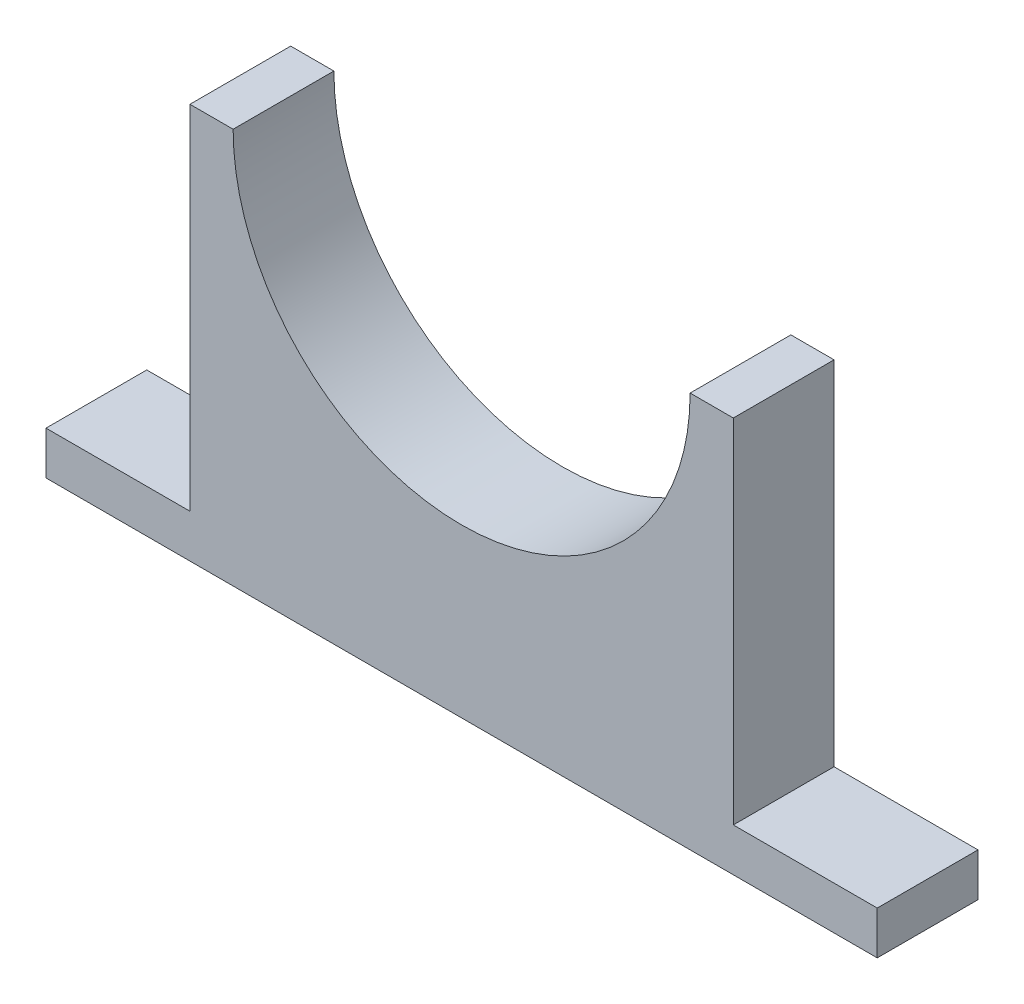
from build123d import *

# Parameters (mm, degrees)
BOSS_EXTRUDE1_DEPTH = 7


with BuildPart() as part:
    # Sketch1 → Boss-Extrude1 (new body)
    with BuildSketch(Plane.XY):
        with BuildLine():
            Line((-15.875, 0), (-18.875, 0))
            Line((-18.875, 0), (-18.875, -24.485))
            Line((-18.875, -24.485), (-28.875, -24.485))
            Line((-28.875, -24.485), (-28.875, -27.485))
            Line((-28.875, -27.485), (28.875, -27.485))
            Line((28.875, -27.485), (28.875, -24.485))
            Line((28.875, -24.485), (18.875, -24.485))
            Line((18.875, -24.485), (18.875, 0))
            Line((18.875, 0), (15.875, 0))
            ThreePointArc((15.875, 0), (0, -15.875), (-15.875, 0))
        make_face()
    extrude(amount=BOSS_EXTRUDE1_DEPTH)


solid = part.part
